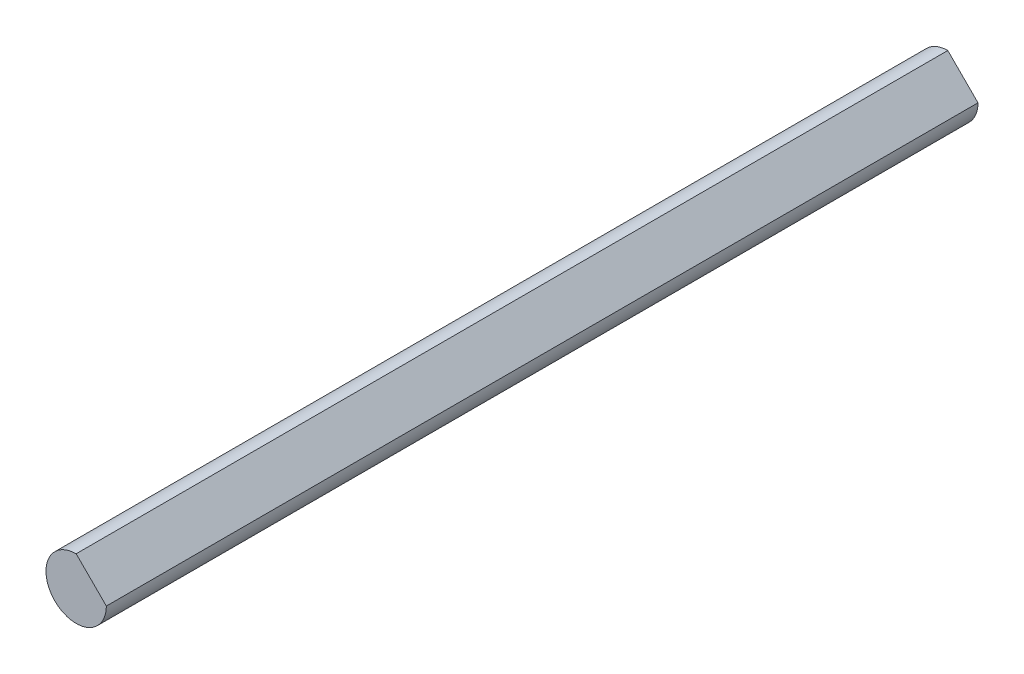
from build123d import *

# Parameters (mm, degrees)
SKETCH1_R           = 3.81
BOSS_EXTRUDE1_DEPTH = 110
CUT_EXTRUDE1_DEPTH  = 111.131885483


with BuildPart() as part:
    # Sketch1 → Boss-Extrude1 (new body)
    with BuildSketch(Plane.XY):
        Circle(SKETCH1_R)
    extrude(amount=BOSS_EXTRUDE1_DEPTH)

    # Sketch2 → Cut-Extrude1 (cut, through all)
    with BuildSketch(Plane.XY.offset(110)):
        Polygon((-19.119345697, 22.929345697), (0, 3.81), (3.81, 0), (22.929345697, -19.119345697), (61.168037091, 19.119345697), (19.119345697, 61.168037091), align=None)
    extrude(amount=-CUT_EXTRUDE1_DEPTH, mode=Mode.SUBTRACT)


solid = part.part
